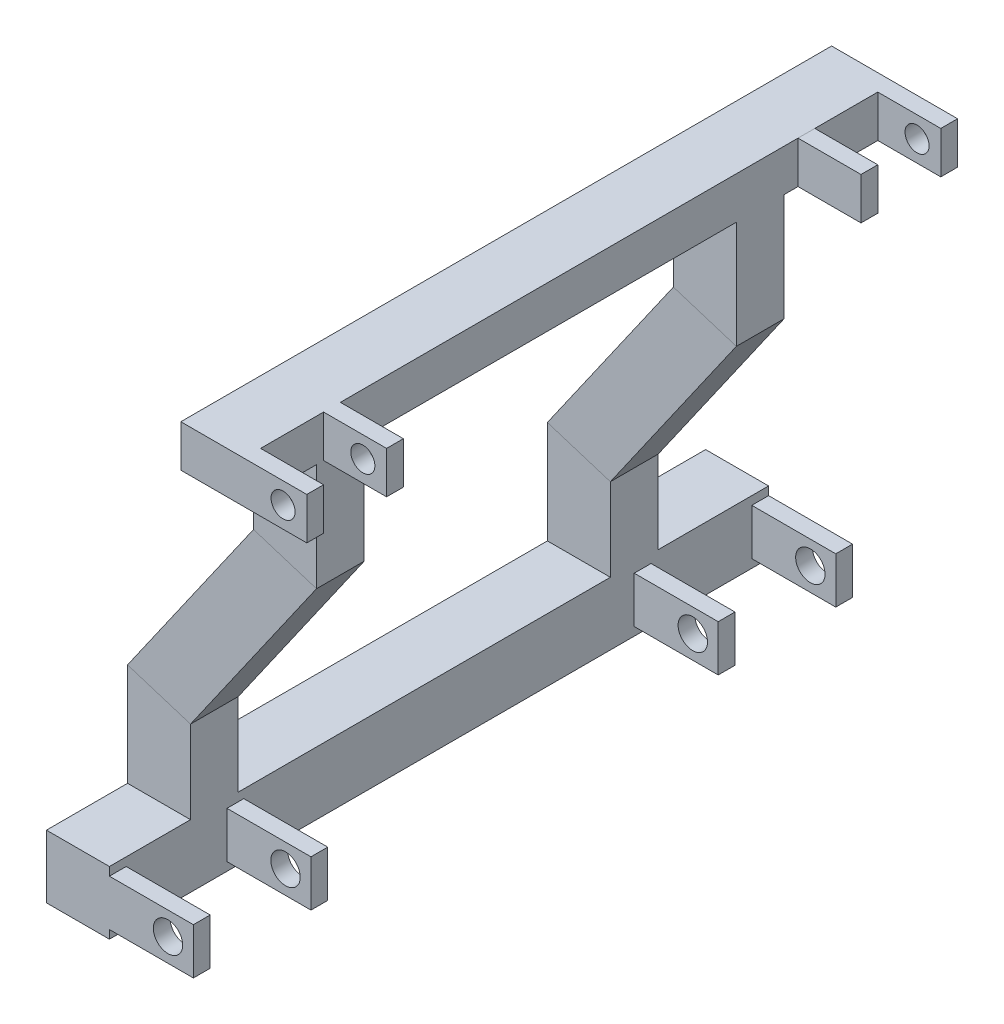
from build123d import *

# Parameters (mm, degrees)
SKETCH1_W               = 15
SKETCH1_H               = 15
BOSS_EXTRUDE1_DEPTH     = 100
SKETCH6_W               = 15
SKETCH6_H               = 11.367788058
SKETCH9_W               = 15
SKETCH9_H               = 10
BOSS_EXTRUDE3_DEPTH     = 88.632211942
SKETCH10_W              = 4
SKETCH10_H              = 11
BOSS_EXTRUDE4_DEPTH     = 20
SKETCH13_W              = 15
SKETCH13_H              = 15
BOSS_EXTRUDE5_DEPTH     = 26.316105971
SKETCH14_W              = 15
SKETCH14_H              = 15
BOSS_EXTRUDE6_DEPTH     = 19.316105971
CUT_EXTRUDE1_DEPTH      = 171.970297301
CUT_EXTRUDE1_DEPTH_BACK = 171.970297301
SKETCH11_R              = 3.498600433
SKETCH15_W              = 4
SKETCH15_H              = 10
BOSS_EXTRUDE7_DEPTH     = 15
SKETCH17_W              = 15
SKETCH17_H              = 10
BOSS_EXTRUDE8_DEPTH     = 17.316105971
SKETCH18_W              = 15
SKETCH18_H              = 10
BOSS_EXTRUDE9_DEPTH     = 26.316105971
CUT_EXTRUDE2_DEPTH      = 197.441252703
CUT_EXTRUDE2_DEPTH_BACK = 197.441252703
SKETCH19_R              = 2.865816397


with BuildPart() as part:
    # Sketch1 → Boss-Extrude1 (new body)
    with BuildSketch(Plane.XY):
        Rectangle(SKETCH1_W, SKETCH1_H)
    extrude(amount=BOSS_EXTRUDE1_DEPTH)



with BuildPart() as body_2:
    # Sweep2: sweep along a path in Sketch5
    with BuildLine(Plane.XY) as sweep2_path:
        Line((0, -7.5), (0, 29.573046855))
        Line((0, 29.573046855), (30.010773466, 72.503120051))
        Line((30.010773466, 72.503120051), (30.010773466, 105.748685256))
    # Sketch6 → Sweep2 (sweep)
    with BuildSketch(Plane.XZ.offset(7.5)):
        Rectangle(SKETCH6_W, SKETCH6_H)
    sweep(path=sweep2_path.line, transition=Transition.RIGHT)


with BuildPart() as body_3:
    # Mirror1: mirrored copy
    add(body_2.part.mirror(Plane(origin=(0, 0, 50), x_dir=(1, 0, 0), z_dir=(0, 0, -1))))


with BuildPart() as body_2_1:
    add(body_2.part)

    add(body_3.part)  # Boss-Extrude3 merges body 3
    # Sketch9 → Boss-Extrude3 (add)
    with BuildSketch(Plane.XY.offset(5.683894029)):
        with Locations((30.010773466, 100.748685256)):
            Rectangle(SKETCH9_W, SKETCH9_H)
    extrude(amount=BOSS_EXTRUDE3_DEPTH)


with BuildPart() as part_1:
    add(part.part)

    add(body_2_1.part)  # Boss-Extrude4 merges body 2
    # Sketch10 → Boss-Extrude4 (add)
    with BuildSketch(Plane(origin=(7.5, 0, 0), x_dir=(0, 0, -1), z_dir=(1, 0, 0))):
        with Locations((-123, 0)):
            Rectangle(SKETCH10_W, SKETCH10_H)
        with Locations((-95, 0)):
            Rectangle(SKETCH10_W, SKETCH10_H)
        with Locations((2, 0)):
            Rectangle(SKETCH10_W, SKETCH10_H)
        with Locations((30, 0)):
            Rectangle(SKETCH10_W, SKETCH10_H)
    extrude(amount=BOSS_EXTRUDE4_DEPTH)

    # Sketch13 → Boss-Extrude5 (add)
    with BuildSketch(Plane(origin=(0, 0, -5.683894029), x_dir=(-1, 0, 0), z_dir=(0, 0, -1))):
        Rectangle(SKETCH13_W, SKETCH13_H)
    extrude(amount=BOSS_EXTRUDE5_DEPTH)

    # Sketch14 → Boss-Extrude6 (add)
    with BuildSketch(Plane.XY.offset(105.683894029)):
        Rectangle(SKETCH14_W, SKETCH14_H)
    extrude(amount=BOSS_EXTRUDE6_DEPTH)

    # Sketch11 → Cut-Extrude1 (cut, two sides: drawn at the far end of the back side and taken through both)
    with BuildSketch(Plane.XY.offset(97).offset(-CUT_EXTRUDE1_DEPTH_BACK)):
        with Locations((21.44815937, 0)):
            Circle(SKETCH11_R)
    extrude(amount=CUT_EXTRUDE1_DEPTH + CUT_EXTRUDE1_DEPTH_BACK, mode=Mode.SUBTRACT)

    # Sketch15 → Boss-Extrude7 (add)
    with BuildSketch(Plane(origin=(37.510773466, 0, 0), x_dir=(0, 0, -1), z_dir=(1, 0, 0))):
        with Locations((-121, 100.748685256)):
            Rectangle(SKETCH15_W, SKETCH15_H)
        with Locations((-102, 100.748685256)):
            Rectangle(SKETCH15_W, SKETCH15_H)
        with Locations((11, 100.748685256)):
            Rectangle(SKETCH15_W, SKETCH15_H)
        with Locations((30, 100.748685256)):
            Rectangle(SKETCH15_W, SKETCH15_H)
    extrude(amount=BOSS_EXTRUDE7_DEPTH)


with BuildPart() as boss_extrude7_piece_1:
    # of the separate pieces the step leaves, piece 1, a body of its own (boss_extrude7_pieces)
    add(part_1.part.solids().sort_by_distance((-7.5, 7.5, -5.683894029))[0])



with BuildPart() as boss_extrude7_piece_2:
    # of the separate pieces the step leaves, piece 2, a body of its own (boss_extrude7_pieces)
    add(part_1.part.solids().sort_by_distance((37.510773466, 95.748685256, 119))[0])


with BuildPart() as boss_extrude7_piece_3:
    # of the separate pieces the step leaves, piece 3, a body of its own (boss_extrude7_pieces)
    add(part_1.part.solids().sort_by_distance((37.510773466, 95.748685256, -32))[0])


with BuildPart() as boss_extrude7_piece_4:
    # of the separate pieces the step leaves, piece 4, a body of its own (boss_extrude7_pieces)
    add(part_1.part.solids().sort_by_distance((37.510773466, 95.748685256, -13))[0])


with BuildPart() as boss_extrude7_piece_1_1:
    add(boss_extrude7_piece_1.part)

    add(boss_extrude7_piece_2.part)  # Boss-Extrude8 merges Boss-Extrude7 piece 2
    # Sketch17 → Boss-Extrude8 (add)
    with BuildSketch(Plane.XY.offset(105.683894029)):
        with Locations((30.010773466, 100.748685256)):
            Rectangle(SKETCH17_W, SKETCH17_H)
    extrude(amount=BOSS_EXTRUDE8_DEPTH)


    add(boss_extrude7_piece_3.part)  # Boss-Extrude9 merges Boss-Extrude7 piece 3
    # Sketch18 → Boss-Extrude9 (add)
    with BuildSketch(Plane(origin=(0, 0, -5.683894029), x_dir=(-1, 0, 0), z_dir=(0, 0, -1))):
        with Locations((-30.010773466, 100.748685256)):
            Rectangle(SKETCH18_W, SKETCH18_H)
    extrude(amount=BOSS_EXTRUDE9_DEPTH)

    # Sketch19 → Cut-Extrude2 (cut, two sides: drawn at the far end of the back side and taken through both)
    with BuildSketch(Plane(origin=(0, 0, -32), x_dir=(-1, 0, 0), z_dir=(0, 0, -1)).offset(-CUT_EXTRUDE2_DEPTH_BACK)):
        with Locations(Location((-46.862290346, 100.748685256, 0), (0, 0, 90))):
            Circle(SKETCH19_R)
    extrude(amount=CUT_EXTRUDE2_DEPTH + CUT_EXTRUDE2_DEPTH_BACK, mode=Mode.SUBTRACT)


solid = Compound([boss_extrude7_piece_4.part, boss_extrude7_piece_1_1.part])
